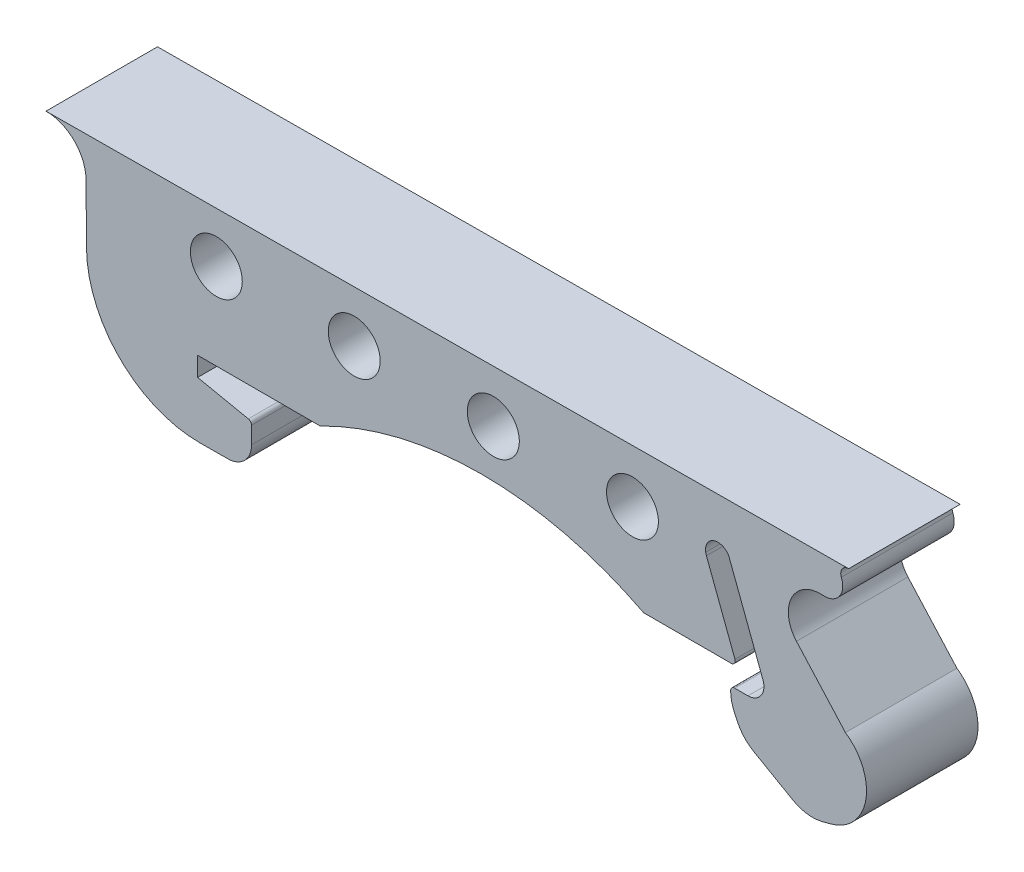
from build123d import *

# Parameters (mm, degrees)
SZKIC1_R                    = 1.63
SZKIC1_R_2                  = 1.627886045
SZKIC1_R_3                  = 1.634186666
SZKIC1_R_4                  = 1.631321013
DODANIE_WYCI_GNI_CIE1_DEPTH = 37.7
SZKIC2_W                    = 96.882996132
SZKIC2_H                    = 10
WYTNIJ_WYCI_GNI_CIE1_DEPTH  = 3.027599165
SZKIC4_W                    = 27.7
SZKIC4_H                    = 3.027599165
DODANIE_WYCI_GNI_CIE2_DEPTH = 4.6
SZKIC5_W                    = 27.7
SZKIC5_H                    = 3.027593756
DODANIE_WYCI_GNI_CIE4_DEPTH = 4.6
WYTNIJ_WYCI_GNI_CIE2_REACH  = 74.407
SZKIC6_R                    = 2.5
SZKIC7_W                    = 110.003784397
SZKIC7_H                    = 59.74457964
WYTNIJ_WYCI_GNI_CIE4_DEPTH  = 30.7


with BuildPart() as part:
    # Szkic1 → Dodanie-wyciągnięcie1 (new body)
    with BuildSketch(Plane(origin=(0, 0, 0), x_dir=(-1, 0, 0), z_dir=(0, 0, 1))):
        with BuildLine():
            Line((-42.206476447, -1.143440143), (-42.187291437, -4.170973113))
            Line((-42.187291437, -4.170973113), (54.693759689, -3.557073712))
            Line((54.693759689, -3.557073712), (54.674575297, -0.529535329))
            Line((54.674575297, -0.529535329), (31.895047363, -0.673880775))
            ThreePointArc((31.895047363, -0.673880775), (30.123615765, 0.046208772), (29.379274421, 1.807587444))
            Line((29.379274421, 1.807587444), (29.351860706, 5.515732081))
            ThreePointArc((29.351860706, 5.515732081), (27.236675167, 10.484490063), (22.240808109, 12.534826154))
            Line((22.240808109, 12.534826154), (20.472861468, 12.523590896))
            ThreePointArc((20.472861468, 12.523590896), (19.415024557, 12.077529638), (18.982423849, 11.01411711))
            Line((18.982423849, 11.01411711), (18.989158593, 9.951213651))
            ThreePointArc((18.989158593, 9.951213651), (19.04575769, 9.79437408), (19.188385802, 9.708006664))
            Line((19.188385802, 9.708006664), (22.37305409, 9.047530924))
            Line((22.37305409, 9.047530924), (22.37305409, 7.841359432))
            Line((22.37305409, 7.841359432), (14.677855674, 7.841359432))
            ThreePointArc((14.677855674, 7.841359432), (4.517774256, 5.390280076), (-5.642307162, 7.841359432))
            Line((-5.642307162, 7.841359432), (-11.13863745, 7.841359432))
            ThreePointArc((-11.13863745, 7.841359432), (-11.344351569, 7.733421748), (-11.372431243, 7.502813045))
            Line((-11.372431243, 7.502813045), (-9.580573211, 2.77167383))
            Line((-9.580573211, 2.77167383), (-9.53660226, 2.594556029))
            ThreePointArc((-9.53660226, 2.594556029), (-10.047085724, 1.71578131), (-10.990723107, 2.09312315))
            Line((-10.990723107, 2.09312315), (-11.062286258, 2.28207519))
            Line((-11.062286258, 2.28207519), (-13.125087597, 7.728600603))
            ThreePointArc((-13.125087597, 7.728600603), (-13.0127689, 8.651035416), (-12.189912428, 9.082786152))
            Line((-12.189912428, 9.082786152), (-11.351176976, 9.082786152))
            ThreePointArc((-11.351176976, 9.082786152), (-11.174400281, 9.156009457), (-11.101176976, 9.332786152))
            Line((-11.101176976, 9.332786152), (-11.101176976, 9.341072815))
            ThreePointArc((-11.101176976, 9.341072815), (-11.158575506, 9.873705952), (-11.328135423, 10.381881202))
            Line((-11.328135423, 10.381881202), (-11.52139656, 10.803947934))
            ThreePointArc((-11.52139656, 10.803947934), (-11.948131465, 11.44871119), (-12.551468508, 11.932246866))
            Line((-12.551468508, 11.932246866), (-15.002316135, 13.336662904))
            ThreePointArc((-15.002316135, 13.336662904), (-15.916443983, 13.645833839), (-16.879567484, 13.585754641))
            Line((-16.879567484, 13.585754641), (-17.376357402, 13.455449083))
            ThreePointArc((-17.376357402, 13.455449083), (-19.591854135, 11.040960081), (-18.31207326, 8.024282466))
            Line((-18.31207326, 8.024282466), (-15.235252345, 4.594263276))
            ThreePointArc((-15.235252345, 4.594263276), (-14.894447251, 2.450948387), (-16.707962408, 1.258845372))
            Line((-16.707962408, 1.258845372), (-16.931951142, 1.257044798))
            ThreePointArc((-16.931951142, 1.257044798), (-17.929768207, 0.793667315), (-18.054097125, -0.299447458))
            ThreePointArc((-18.054097125, -0.299447458), (-18.09762478, -0.768632421), (-18.511820167, -0.993290758))
            Line((-18.511820167, -0.993290758), (-42.206476447, -1.143440143))
        make_face()
        with Locations(Location((21.198480742, 2.425447379, 0), (0, 0, 180))):
            Circle(SZKIC1_R, mode=Mode.SUBTRACT)
        with Locations(Location((-4.937145948, 2.427386246, 0), (0, 0, 180))):
            Circle(SZKIC1_R_2, mode=Mode.SUBTRACT)
        with Locations(Location((3.802928012, 2.422545785, 0), (0, 0, 180))):
            Circle(SZKIC1_R_3, mode=Mode.SUBTRACT)
        with Locations(Location((12.538480742, 2.425447379, 0), (0, 0, 180))):
            Circle(SZKIC1_R_4, mode=Mode.SUBTRACT)
    extrude(amount=DODANIE_WYCI_GNI_CIE1_DEPTH)

    # Szkic2 → Wytnij-wyciągnięcie1 (cut)
    with BuildSketch(Plane(origin=(-0.02473498, 3.903491109, 0), x_dir=(0.9999799241630359, 0.006336503048932176, 0), z_dir=(-0.006336503048932176, 0.9999799241630359, 0))):
        with Locations((-6.228624191, -32.7)):
            Rectangle(SZKIC2_W, SZKIC2_H)
    extrude(amount=-WYTNIJ_WYCI_GNI_CIE1_DEPTH, mode=Mode.SUBTRACT)

    # Szkic4 → Dodanie-wyciągnięcie2 (add)
    with BuildSketch(Plane(origin=(-54.669024709, -0.346417396, 0), x_dir=(0, 0, 1), z_dir=(-0.9999799241630359, -0.006336503048932243, 0))):
        with Locations((13.85, 2.389769894)):
            Rectangle(SZKIC4_W, SZKIC4_H)
    extrude(amount=DODANIE_WYCI_GNI_CIE2_DEPTH)

    # Szkic5 → Dodanie-wyciągnięcie4 (add)
    with BuildSketch(Plane(origin=(42.212027201, 0.26749111, 0), x_dir=(0, 0, -1), z_dir=(0.9999799227968423, 0.00633671864778665, 0))):
        with Locations((-13.85, 2.389763497)):
            Rectangle(SZKIC5_W, SZKIC5_H)
    extrude(amount=DODANIE_WYCI_GNI_CIE4_DEPTH)

    # Wytnij-wyciągnięcie2: up to this face of the body (flat: up to its plane)
    wytnij_wyci_gni_cie2_end = Plane(part.part.faces().sort_by_distance((-45.584765156, 0.587134095, 13.85))[0])
    # Szkic6 → Wytnij-wyciągnięcie2 (cut, up to the picked face)
    with BuildSketch(Plane(origin=(-0.02473498, 3.903491109, 0), x_dir=(0.9999799241630359, 0.006336503048932172, 0), z_dir=(-0.006336503048932172, 0.9999799241630359, 0)), mode=Mode.PRIVATE) as wytnij_wyci_gni_cie2_sk1:
        with Locations((-53.770122257, -7.5)):
            Circle(SZKIC6_R)
    wytnij_wyci_gni_cie2_tool1 = split(extrude(wytnij_wyci_gni_cie2_sk1.sketch, amount=-WYTNIJ_WYCI_GNI_CIE2_REACH, mode=Mode.PRIVATE), bisect_by=wytnij_wyci_gni_cie2_end, keep=Keep.BOTH, mode=Mode.PRIVATE)
    # Szkic6 → Wytnij-wyciągnięcie2 (cut, up to the picked face)
    with BuildSketch(Plane(origin=(-0.02473498, 3.903491109, 0), x_dir=(0.9999799241630359, 0.006336503048932172, 0), z_dir=(-0.006336503048932172, 0.9999799241630359, 0)), mode=Mode.PRIVATE) as wytnij_wyci_gni_cie2_sk2:
        with Locations((41.312873875, -7.5)):
            Circle(SZKIC6_R)
    wytnij_wyci_gni_cie2_tool2 = split(extrude(wytnij_wyci_gni_cie2_sk2.sketch, amount=-WYTNIJ_WYCI_GNI_CIE2_REACH, mode=Mode.PRIVATE), bisect_by=wytnij_wyci_gni_cie2_end, keep=Keep.BOTH, mode=Mode.PRIVATE)
    add(wytnij_wyci_gni_cie2_tool1.solids().sort_by(Axis((-53.793778, 3.562777, 7.5), (0.006336503048932172, -0.9999799241630359, 0)))[0], mode=Mode.SUBTRACT)
    add(wytnij_wyci_gni_cie2_tool2.solids().sort_by(Axis((41.28731, 4.16527, 7.5), (0.006336503048932172, -0.9999799241630359, 0)))[0], mode=Mode.SUBTRACT)

    # Szkic7 → Wytnij-wyciągnięcie4 (cut)
    with BuildSketch(Plane(origin=(0, 0, 0), x_dir=(-1, 0, 0), z_dir=(0, 0, -1))):
        with Locations((7.955893791, -24.915165787)):
            Rectangle(SZKIC7_W, SZKIC7_H)
    extrude(amount=-WYTNIJ_WYCI_GNI_CIE4_DEPTH, mode=Mode.SUBTRACT)


with BuildPart() as wytnij_wyci_gni_cie4_kept_piece:
    # of the separate pieces the step leaves, the one the design keeps (wytnij_wyci_gni_cie4_pieces_kept)
    add(part.part.solids().sort_by_distance((18.31207326, -8.024282466, 30.7))[0])


solid = wytnij_wyci_gni_cie4_kept_piece.part
